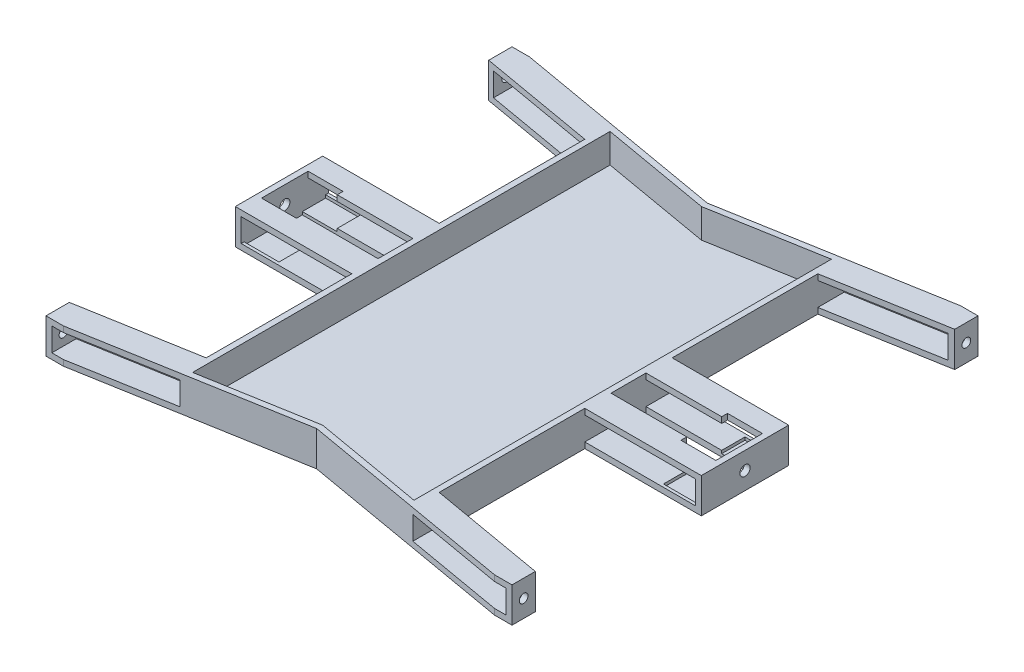
from build123d import *

# Parameters (mm, degrees)
BOSS_EXTRUDE1_DEPTH      = 6
BOSS_EXTRUDE1_DEPTH_BACK = 6
SKETCH2_W                = 156
SKETCH2_H                = 8
CUT_EXTRUDE1_DEPTH       = 160
SKETCH4_W                = 38
SKETCH4_H                = 12
CUT_EXTRUDE2_DEPTH       = 12
CUT_EXTRUDE3_DEPTH       = 114.296072306
CUT_EXTRUDE3_DEPTH_BACK  = 114.296072306
SKETCH6_R                = 1.5
CUT_EXTRUDE4_REACH       = 180.986
SKETCH7_R                = 1.75
SKETCH8_W                = 12
SKETCH8_H                = 16
CUT_EXTRUDE5_DEPTH       = 2
SKETCH9_W                = 12
SKETCH9_H                = 28
CUT_EXTRUDE6_DEPTH       = 1
CUT_EXTRUDE7_DEPTH       = 2
BOSS_EXTRUDE2_DEPTH      = 10


with BuildPart() as part:
    # Sketch1 → Boss-Extrude1 (new, two sides: drawn at the far end of the back side and taken through both)
    with BuildSketch(Plane(origin=(0, 0, 0), x_dir=(1, 0, 0), z_dir=(0, 1, 0)).offset(-BOSS_EXTRUDE1_DEPTH_BACK)):
        Polygon((80, 15), (80, -15), (40, -15), (40, -65), (80, -72), (80, -80), (74, -80), (0, -67.05), (-74, -80), (-80, -80), (-80, -72), (-40, -65), (-40, -15), (-80, -15), (-80, 15), (-40, 15), (-40, 65), (-80, 72), (-80, 80), (-74, 80), (0, 67.05), (74, 80), (80, 80), (80, 72), (40, 65), (40, 15), align=None)
    extrude(amount=BOSS_EXTRUDE1_DEPTH + BOSS_EXTRUDE1_DEPTH_BACK)

    # Sketch2 → Cut-Extrude1 (cut)
    with BuildSketch(Plane.XY.offset(80)):
        Rectangle(SKETCH2_W, SKETCH2_H)
    extrude(amount=-CUT_EXTRUDE1_DEPTH, mode=Mode.SUBTRACT)

    # Sketch4 → Cut-Extrude2 (cut)
    with BuildSketch(Plane(origin=(0, 6, 0), x_dir=(1, 0, 0), z_dir=(0, 1, 0))):
        with Locations((-59, 0)):
            Rectangle(SKETCH4_W, SKETCH4_H)
        with Locations((59, 0)):
            Rectangle(SKETCH4_W, SKETCH4_H)
    extrude(amount=-CUT_EXTRUDE2_DEPTH, mode=Mode.SUBTRACT)

    # Sketch6 → Cut-Extrude3 (cut, two sides: drawn at the far end of the back side and taken through both)
    with BuildSketch(Plane(origin=(0, 0, 0), x_dir=(0, 0, -1), z_dir=(1, 0, 0)).offset(-CUT_EXTRUDE3_DEPTH_BACK)):
        with Locations((-76, 0)):
            Circle(SKETCH6_R)
        with Locations((76, 0)):
            Circle(SKETCH6_R)
    extrude(amount=CUT_EXTRUDE3_DEPTH + CUT_EXTRUDE3_DEPTH_BACK, mode=Mode.SUBTRACT)

    # Cut-Extrude4: up to this face of the body (flat: up to its plane)
    cut_extrude4_end = Plane(part.part.faces().sort_by_distance((-80, 0, 0))[0])
    # Sketch7 → Cut-Extrude4 (cut, up to the picked face)
    with BuildSketch(Plane(origin=(80, 0, 0), x_dir=(0, 0, -1), z_dir=(1, 0, 0)), mode=Mode.PRIVATE) as cut_extrude4_sk1:
        Circle(SKETCH7_R)
    cut_extrude4_tool1 = split(extrude(cut_extrude4_sk1.sketch, amount=-CUT_EXTRUDE4_REACH, mode=Mode.PRIVATE), bisect_by=cut_extrude4_end, keep=Keep.BOTH, mode=Mode.PRIVATE)
    add(cut_extrude4_tool1.solids().sort_by(Axis((80, 0, 0), (-1, 0, 0)))[0], mode=Mode.SUBTRACT)

    # Sketch8 → Cut-Extrude5 (cut)
    with BuildSketch(Plane(origin=(0, 6, 0), x_dir=(1, 0, 0), z_dir=(0, 1, 0))):
        with Locations((72, 0)):
            Rectangle(SKETCH8_W, SKETCH8_H)
        with Locations((-72, 0)):
            Rectangle(SKETCH8_W, SKETCH8_H)
    extrude(amount=-CUT_EXTRUDE5_DEPTH, mode=Mode.SUBTRACT)

    # Sketch9 → Cut-Extrude6 (cut)
    with BuildSketch(Plane(origin=(0, -4, 0), x_dir=(1, 0, 0), z_dir=(0, 1, 0))):
        with Locations((72, 0)):
            Rectangle(SKETCH9_W, SKETCH9_H)
        with Locations((-72, 0)):
            Rectangle(SKETCH9_W, SKETCH9_H)
    extrude(amount=-CUT_EXTRUDE6_DEPTH, mode=Mode.SUBTRACT)

    # Sketch11 → Cut-Extrude7 (cut)
    with BuildSketch(Plane(origin=(0, 6, 0), x_dir=(1, 0, 0), z_dir=(0, 1, 0))):
        Polygon((-40, -74.05), (-40, 74.05), (0, 67.05), (40, 74.05), (40, -74.05), (0, -67.05), align=None)
    extrude(amount=-CUT_EXTRUDE7_DEPTH, mode=Mode.SUBTRACT)

    # Sketch12 → Boss-Extrude2 (add)
    with BuildSketch(Plane(origin=(0, -4, 0), x_dir=(1, 0, 0), z_dir=(0, 1, 0))):
        Polygon((-40, 74.05), (-40, -74.05), (0, -67.05), (40, -74.05), (40, 74.05), (0, 67.05), align=None)
        Polygon((0, 65.01960595), (38, 71.66960595), (38, -71.66960595), (0, -65.01960595), (-38, -71.66960595), (-38, 71.66960595), align=None, mode=Mode.SUBTRACT)
    extrude(amount=BOSS_EXTRUDE2_DEPTH)


solid = part.part
